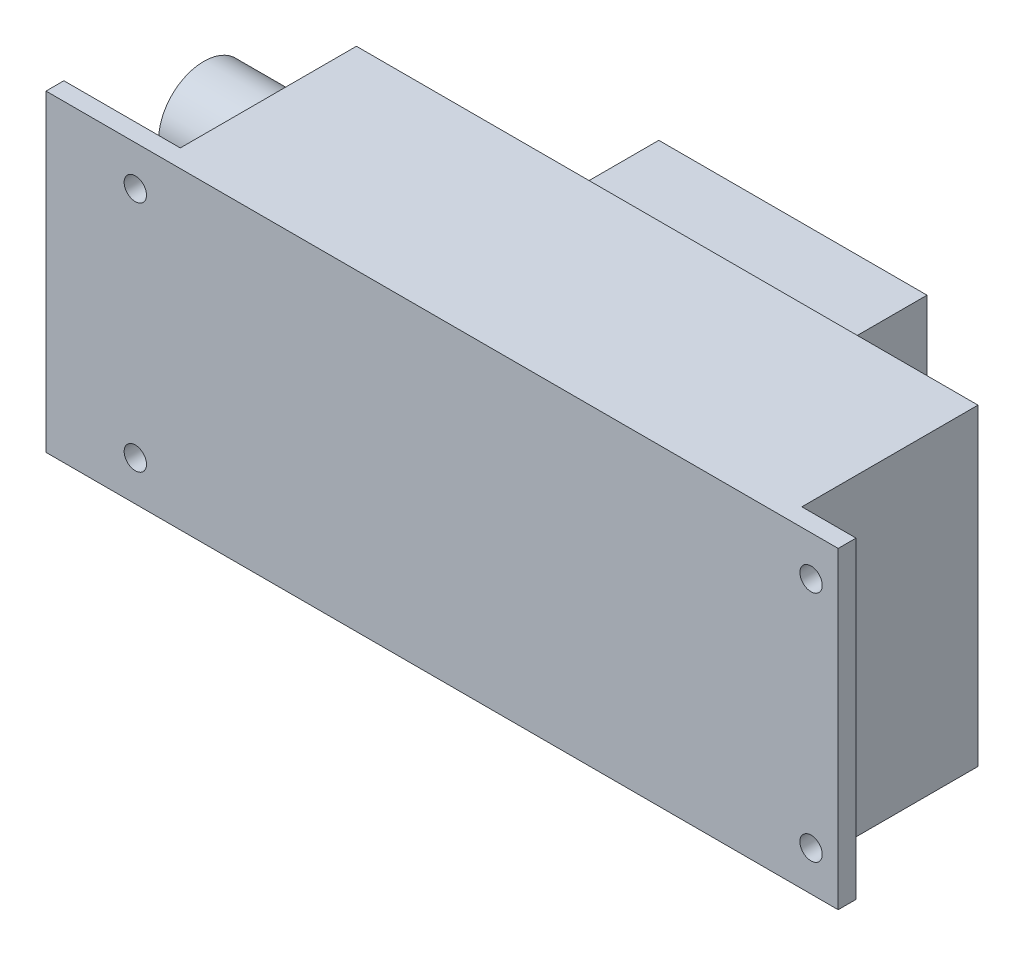
from build123d import *

# Parameters (mm, degrees)
SKETCH1_W                   = 88.6
SKETCH1_H                   = 35
BOSS_EXTRUDE1_DEPTH         = 32
TAP_DRILL_FOR_M3X0_5_TAP1_D = 2.5
SKETCH4_W                   = 6.06
SKETCH4_H                   = 35
SKETCH4_W_2                 = 13.02
CUT_EXTRUDE2_DEPTH          = 30
SKETCH5_OUTSIDE_W           = 110.698
SKETCH5_OUTSIDE_H           = 57.098
SKETCH5_OUTSIDE_W_2         = 30
SKETCH5_OUTSIDE_H_2         = 30
CUT_EXTRUDE3_DEPTH          = 10.3
BOSS_EXTRUDE2_DEPTH         = 13.02


with BuildPart() as part:
    # Sketch1 → Boss-Extrude1 (new body)
    with BuildSketch(Plane.XY):
        with Locations((44.3, 17.5)):
            Rectangle(SKETCH1_W, SKETCH1_H)
    extrude(amount=BOSS_EXTRUDE1_DEPTH)

    # Tap Drill for M3x0.5 Tap1 (through all)
    with Locations(Plane.XY.offset(32)):
        with Locations((9.99, 30.535), (9.99, 4.465), (85.57, 4.465), (85.57, 30.535)):
            Hole(TAP_DRILL_FOR_M3X0_5_TAP1_D / 2)

    # Sketch4 → Cut-Extrude2 (cut)
    with BuildSketch(Plane(origin=(0, 0, 0), x_dir=(-1, 0, 0), z_dir=(0, 0, -1))):
        with Locations((-85.57, 17.5)):
            Rectangle(SKETCH4_W, SKETCH4_H)
        with Locations((-6.51, 17.5)):
            Rectangle(SKETCH4_W_2, SKETCH4_H)
    extrude(amount=-CUT_EXTRUDE2_DEPTH, mode=Mode.SUBTRACT)

    # Sketch5 outside → Cut-Extrude3 (cut)
    with BuildSketch(Plane(origin=(0, 0, 0), x_dir=(-1, 0, 0), z_dir=(0, 0, -1))):
        with Locations((-44.3, 17.5)):
            Rectangle(SKETCH5_OUTSIDE_W, SKETCH5_OUTSIDE_H)
        with Locations((-51.54, 17.5)):
            Rectangle(SKETCH5_OUTSIDE_W_2, SKETCH5_OUTSIDE_H_2, mode=Mode.SUBTRACT)
    extrude(amount=-CUT_EXTRUDE3_DEPTH, mode=Mode.SUBTRACT)

    # Sketch6 → Boss-Extrude2 (add)
    with BuildSketch(Plane.ZY.offset(-13.02)):
        with BuildLine():
            Line((19.4, 24.005), (19.4, 10.995))
            ThreePointArc((19.4, 10.995), (14.35, 5.945), (9.3, 10.995))
            Line((9.3, 10.995), (9.3, 24.005))
            ThreePointArc((9.3, 24.005), (14.35, 29.055), (19.4, 24.005))
        make_face()
    extrude(amount=BOSS_EXTRUDE2_DEPTH)


solid = part.part
